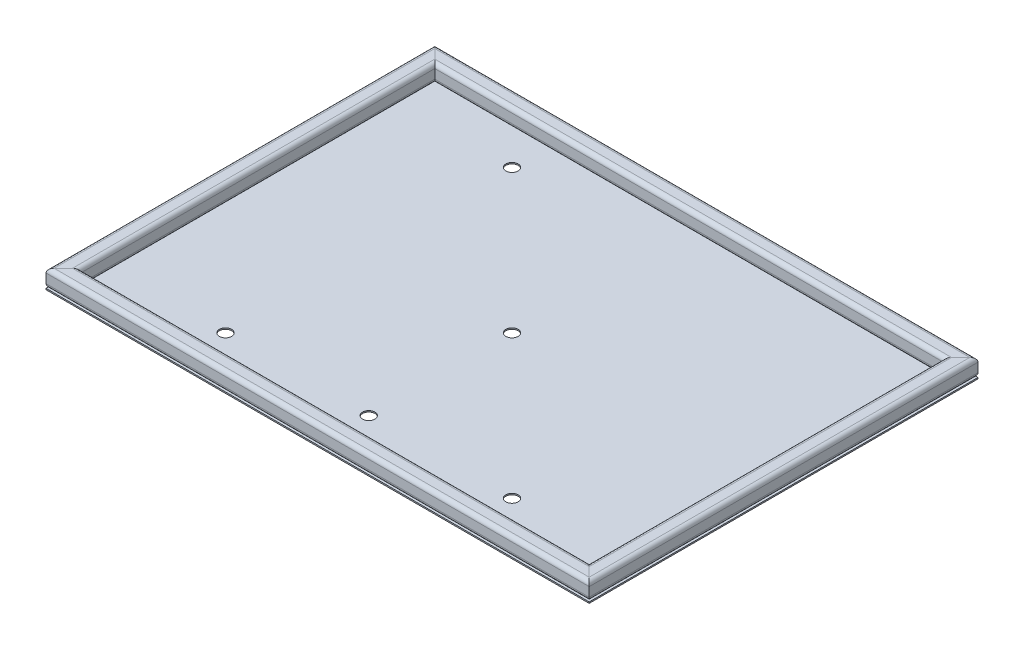
from build123d import *

# Parameters (mm, degrees)
TUBO_CUADRADO_2_X_2_X_0_25_1_DEPTH      = 606.921024484
TUBO_CUADRADO_2_X_2_X_0_25_1_DEPTH_BACK = 36.921024484
TUBO_CUADRADO_2_X_2_X_0_25_1_2_DEPTH    = 870.242048969
TUBO_CUADRADO_2_X_2_X_0_25_1_3_DEPTH    = 643.842048969
TUBO_CUADRADO_2_X_2_X_0_25_1_4_DEPTH    = 870.242048969
CROQUIS3_W                              = 796.4
CROQUIS3_H                              = 570
SALIENTE_EXTRUIR1_DEPTH                 = 1.9
CROQUIS6_R                              = 9
CORTAR_EXTRUIR2_DEPTH                   = 10


with BuildPart() as part:
    # Sketch1 → Tubo cuadrado 2 X 2 X 0.25(1) (new, two sides: drawn at the far end of the back side and taken through both)
    with BuildSketch(Plane(origin=(-385.5, 12.7, -285), x_dir=(1, 0, 0), z_dir=(0, 0, 1)).offset(-TUBO_CUADRADO_2_X_2_X_0_25_1_DEPTH_BACK)):
        with BuildLine():
            Line((-6.7, -12.7), (6.7, -12.7))
            ThreePointArc((6.7, -12.7), (10.942640687, -10.942640687), (12.7, -6.7))
            Line((12.7, -6.7), (12.7, 6.7))
            ThreePointArc((12.7, 6.7), (10.942640687, 10.942640687), (6.7, 12.7))
            Line((6.7, 12.7), (-6.7, 12.7))
            ThreePointArc((-6.7, 12.7), (-10.942640687, 10.942640687), (-12.7, 6.7))
            Line((-12.7, 6.7), (-12.7, -6.7))
            ThreePointArc((-12.7, -6.7), (-10.942640687, -10.942640687), (-6.7, -12.7))
        make_face()
        with BuildLine():
            Line((-6.7, -9.7), (6.7, -9.7))
            ThreePointArc((6.7, -9.7), (8.821320344, -8.821320344), (9.7, -6.7))
            Line((9.7, -6.7), (9.7, 6.7))
            ThreePointArc((9.7, 6.7), (8.821320344, 8.821320344), (6.7, 9.7))
            Line((6.7, 9.7), (-6.7, 9.7))
            ThreePointArc((-6.7, 9.7), (-8.821320344, 8.821320344), (-9.7, 6.7))
            Line((-9.7, 6.7), (-9.7, -6.7))
            ThreePointArc((-9.7, -6.7), (-8.821320344, -8.821320344), (-6.7, -9.7))
        make_face(mode=Mode.SUBTRACT)
    extrude(amount=TUBO_CUADRADO_2_X_2_X_0_25_1_DEPTH + TUBO_CUADRADO_2_X_2_X_0_25_1_DEPTH_BACK)

    # Tubo cuadrado 2 X 2 X 0.25(1) mitre 1
    split(bisect_by=Plane(origin=(-398.2, 0, -285), x_dir=(0, -1, 0), z_dir=(-0.707106781, 0, 0.707106781)), keep=Keep.TOP)

    # Tubo cuadrado 2 X 2 X 0.25(1) mitre 2
    split(bisect_by=Plane(origin=(-398.2, 0, 285), x_dir=(0, -1, 0), z_dir=(-0.707106781, 0, -0.707106781)), keep=Keep.TOP)


with BuildPart() as body_2:
    # Sketch1 on segment 2 (carried to segment 2) → Tubo cuadrado 2 X 2 X 0.25_1 2 (new body)
    with BuildSketch(Plane(origin=(-435.121024484, 12.7, 272.3), x_dir=(0, 0, -1), z_dir=(1, 0, 0))):
        with BuildLine():
            Line((-6.7, -12.7), (6.7, -12.7))
            ThreePointArc((6.7, -12.7), (10.942640687, -10.942640687), (12.7, -6.7))
            Line((12.7, -6.7), (12.7, 6.7))
            ThreePointArc((12.7, 6.7), (10.942640687, 10.942640687), (6.7, 12.7))
            Line((6.7, 12.7), (-6.7, 12.7))
            ThreePointArc((-6.7, 12.7), (-10.942640687, 10.942640687), (-12.7, 6.7))
            Line((-12.7, 6.7), (-12.7, -6.7))
            ThreePointArc((-12.7, -6.7), (-10.942640687, -10.942640687), (-6.7, -12.7))
        make_face()
        with BuildLine():
            Line((-6.7, -9.7), (6.7, -9.7))
            ThreePointArc((6.7, -9.7), (8.821320344, -8.821320344), (9.7, -6.7))
            Line((9.7, -6.7), (9.7, 6.7))
            ThreePointArc((9.7, 6.7), (8.821320344, 8.821320344), (6.7, 9.7))
            Line((6.7, 9.7), (-6.7, 9.7))
            ThreePointArc((-6.7, 9.7), (-8.821320344, 8.821320344), (-9.7, 6.7))
            Line((-9.7, 6.7), (-9.7, -6.7))
            ThreePointArc((-9.7, -6.7), (-8.821320344, -8.821320344), (-6.7, -9.7))
        make_face(mode=Mode.SUBTRACT)
    extrude(amount=TUBO_CUADRADO_2_X_2_X_0_25_1_2_DEPTH)

    # Tubo cuadrado 2 X 2 X 0.25_1 2 mitre 1
    split(bisect_by=Plane(origin=(-398.2, 0, 285), x_dir=(0, 1, 0), z_dir=(0.707106781, 0, 0.707106781)), keep=Keep.TOP)

    # Tubo cuadrado 2 X 2 X 0.25_1 2 mitre 2
    split(bisect_by=Plane(origin=(398.2, 0, 285), x_dir=(0, -1, 0), z_dir=(-0.707106781, 0, 0.707106781)), keep=Keep.TOP)


with BuildPart() as body_3:
    # Sketch1 on segment 3 (carried to segment 3) → Tubo cuadrado 2 X 2 X 0.25_1 3 (new body)
    with BuildSketch(Plane(origin=(385.5, 12.7, 321.921024484), x_dir=(-1, 0, 0), z_dir=(0, 0, -1))):
        with BuildLine():
            Line((-6.7, -12.7), (6.7, -12.7))
            ThreePointArc((6.7, -12.7), (10.942640687, -10.942640687), (12.7, -6.7))
            Line((12.7, -6.7), (12.7, 6.7))
            ThreePointArc((12.7, 6.7), (10.942640687, 10.942640687), (6.7, 12.7))
            Line((6.7, 12.7), (-6.7, 12.7))
            ThreePointArc((-6.7, 12.7), (-10.942640687, 10.942640687), (-12.7, 6.7))
            Line((-12.7, 6.7), (-12.7, -6.7))
            ThreePointArc((-12.7, -6.7), (-10.942640687, -10.942640687), (-6.7, -12.7))
        make_face()
        with BuildLine():
            Line((-6.7, -9.7), (6.7, -9.7))
            ThreePointArc((6.7, -9.7), (8.821320344, -8.821320344), (9.7, -6.7))
            Line((9.7, -6.7), (9.7, 6.7))
            ThreePointArc((9.7, 6.7), (8.821320344, 8.821320344), (6.7, 9.7))
            Line((6.7, 9.7), (-6.7, 9.7))
            ThreePointArc((-6.7, 9.7), (-8.821320344, 8.821320344), (-9.7, 6.7))
            Line((-9.7, 6.7), (-9.7, -6.7))
            ThreePointArc((-9.7, -6.7), (-8.821320344, -8.821320344), (-6.7, -9.7))
        make_face(mode=Mode.SUBTRACT)
    extrude(amount=TUBO_CUADRADO_2_X_2_X_0_25_1_3_DEPTH)

    # Tubo cuadrado 2 X 2 X 0.25_1 3 mitre 1
    split(bisect_by=Plane(origin=(398.2, 0, -285), x_dir=(0, 1, 0), z_dir=(0.707106781, 0, 0.707106781)), keep=Keep.TOP)

    # Tubo cuadrado 2 X 2 X 0.25_1 3 mitre 2
    split(bisect_by=Plane(origin=(398.2, 0, 285), x_dir=(0, 1, 0), z_dir=(0.707106781, 0, -0.707106781)), keep=Keep.TOP)


with BuildPart() as body_4:
    # Sketch1 on segment 4 (carried to segment 4) → Tubo cuadrado 2 X 2 X 0.25_1 4 (new body)
    with BuildSketch(Plane(origin=(435.121024484, 12.7, -272.3), x_dir=(0, 0, 1), z_dir=(-1, 0, 0))):
        with BuildLine():
            Line((-6.7, -12.7), (6.7, -12.7))
            ThreePointArc((6.7, -12.7), (10.942640687, -10.942640687), (12.7, -6.7))
            Line((12.7, -6.7), (12.7, 6.7))
            ThreePointArc((12.7, 6.7), (10.942640687, 10.942640687), (6.7, 12.7))
            Line((6.7, 12.7), (-6.7, 12.7))
            ThreePointArc((-6.7, 12.7), (-10.942640687, 10.942640687), (-12.7, 6.7))
            Line((-12.7, 6.7), (-12.7, -6.7))
            ThreePointArc((-12.7, -6.7), (-10.942640687, -10.942640687), (-6.7, -12.7))
        make_face()
        with BuildLine():
            Line((-6.7, -9.7), (6.7, -9.7))
            ThreePointArc((6.7, -9.7), (8.821320344, -8.821320344), (9.7, -6.7))
            Line((9.7, -6.7), (9.7, 6.7))
            ThreePointArc((9.7, 6.7), (8.821320344, 8.821320344), (6.7, 9.7))
            Line((6.7, 9.7), (-6.7, 9.7))
            ThreePointArc((-6.7, 9.7), (-8.821320344, 8.821320344), (-9.7, 6.7))
            Line((-9.7, 6.7), (-9.7, -6.7))
            ThreePointArc((-9.7, -6.7), (-8.821320344, -8.821320344), (-6.7, -9.7))
        make_face(mode=Mode.SUBTRACT)
    extrude(amount=TUBO_CUADRADO_2_X_2_X_0_25_1_4_DEPTH)

    # Tubo cuadrado 2 X 2 X 0.25_1 4 mitre 1
    split(bisect_by=Plane(origin=(-398.2, 0, -285), x_dir=(0, 1, 0), z_dir=(0.707106781, 0, -0.707106781)), keep=Keep.TOP)

    # Tubo cuadrado 2 X 2 X 0.25_1 4 mitre 2
    split(bisect_by=Plane(origin=(398.2, 0, -285), x_dir=(0, -1, 0), z_dir=(-0.707106781, 0, -0.707106781)), keep=Keep.TOP)


with BuildPart() as body_5:
    # Croquis3 → Saliente-Extruir1 (new body)
    with BuildSketch(Plane.XZ):
        Rectangle(CROQUIS3_W, CROQUIS3_H)
    extrude(amount=SALIENTE_EXTRUIR1_DEPTH)

    # Croquis6 → Cortar-Extruir2 (cut)
    with BuildSketch(Plane.XZ.offset(1.9)):
        Circle(CROQUIS6_R)
        with Locations((210, 210)):
            Circle(CROQUIS6_R)
        with Locations((0, 210)):
            Circle(CROQUIS6_R)
        with Locations((-210, 210)):
            Circle(CROQUIS6_R)
        with Locations((-210, -210)):
            Circle(CROQUIS6_R)
    extrude(amount=-CORTAR_EXTRUIR2_DEPTH, mode=Mode.SUBTRACT)


solid = Compound([part.part, body_2.part, body_3.part, body_4.part, body_5.part])
